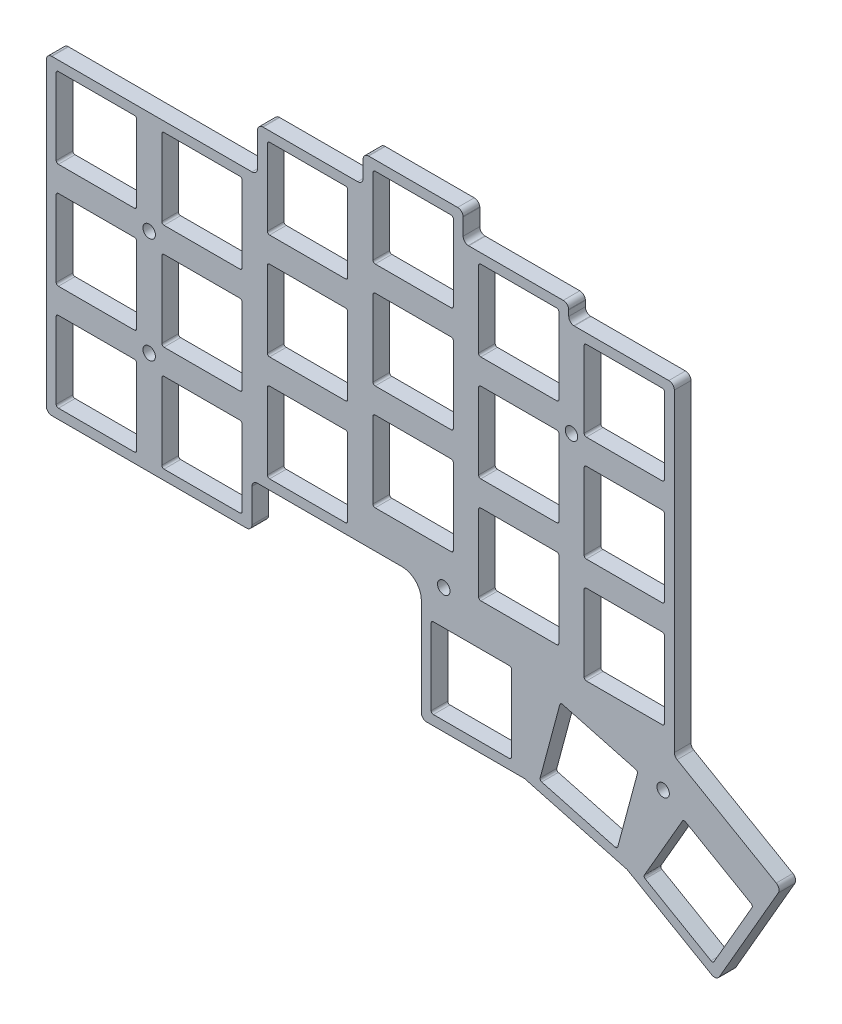
from build123d import *

# Parameters (mm, degrees)
BOSS_EXTRUDE1_START = 5
BOSS_EXTRUDE1_DEPTH = 3
CUT_EXTRUDE1_DEPTH  = 3
CUT_EXTRUDE2_DEPTH  = 3
CUT_EXTRUDE3_DEPTH  = 3
SKETCH6_R           = 1.125
CUT_EXTRUDE4_DEPTH  = 3


with BuildPart() as part:
    # Sketch1 → Boss-Extrude1 (new body)
    with BuildSketch(Plane.XY.offset(BOSS_EXTRUDE1_START)):
        with BuildLine():
            Line((-43.412279, 85.144111), (-59.462279, 85.144111))
            Line((-59.462279, 85.144111), (-59.560533, 85.141704))
            ThreePointArc((-59.560533, 85.141704), (-60.204711116, 84.817640196), (-60.462279, 84.144111))
            Line((-60.462279, 84.144111), (-60.462279, 81.144111))
            Line((-60.462279, 81.144111), (-60.464686, 81.045857))
            ThreePointArc((-60.464686, 81.045857), (-60.788749804, 80.401678884), (-61.462279, 80.144111))
            Line((-61.462279, 80.144111), (-67.612279, 80.144111))
            Line((-67.612279, 80.144111), (-72.362279, 80.144111))
            Line((-72.362279, 80.144111), (-78.512279, 80.144111))
            Line((-78.512279, 80.144111), (-78.610533, 80.141704))
            ThreePointArc((-78.610533, 80.141704), (-79.254711116, 79.817640196), (-79.512279, 79.144111))
            Line((-79.512279, 79.144111), (-79.512279, 73.144111))
            Line((-79.512279, 73.144111), (-79.514686, 73.045857))
            ThreePointArc((-79.514686, 73.045857), (-79.838749804, 72.401678884), (-80.512279, 72.144111))
            Line((-80.512279, 72.144111), (-116.612279, 72.144111))
            Line((-116.612279, 72.144111), (-116.710533, 72.141704))
            ThreePointArc((-116.710533, 72.141704), (-117.354711116, 71.817640196), (-117.612279, 71.144111))
            Line((-117.612279, 71.144111), (-117.612279, 16.994111))
            Line((-117.612279, 16.994111), (-117.609872, 16.895857))
            ThreePointArc((-117.609872, 16.895857), (-117.285808196, 16.251678884), (-116.612279, 15.994111))
            Line((-116.612279, 15.994111), (-101.437279, 15.994111))
            Line((-101.437279, 15.994111), (-96.687279, 15.994111))
            Line((-96.687279, 15.994111), (-81.512279, 15.994111))
            Line((-81.512279, 15.994111), (-81.414025, 15.996518))
            ThreePointArc((-81.414025, 15.996518), (-80.769846884, 16.320581804), (-80.512279, 16.994111))
            Line((-80.512279, 16.994111), (-80.512279, 22.994111))
            Line((-80.512279, 22.994111), (-80.509872, 23.092365))
            ThreePointArc((-80.509872, 23.092365), (-80.185808196, 23.736543116), (-79.512279, 23.994111))
            Line((-79.512279, 23.994111), (-53.462279, 23.994111))
            Line((-53.462279, 23.994111), (-53.278977, 23.991713))
            ThreePointArc((-53.278977, 23.991713), (-50.922055604, 22.905352629), (-49.962279, 20.494111))
            Line((-49.962279, 20.494111), (-49.962279, 2.944111))
            Line((-49.962279, 2.944111), (-49.959872, 2.845857))
            ThreePointArc((-49.959872, 2.845857), (-49.635808196, 2.201678884), (-48.962279, 1.944111))
            Line((-48.962279, 1.944111), (-31.346453, 1.944111))
            Line((-31.346453, 1.944111), (-12.818399, -3.020466))
            Line((-12.818399, -3.020466), (2.437354, -11.828379))
            Line((2.437354, -11.828379), (2.523644, -11.875428))
            ThreePointArc((2.523644, -11.875428), (3.24353, -11.916930612), (3.803337, -11.462426))
            Line((3.803337, -11.462426), (17.333763, 11.972959))
            Line((17.333763, 11.972959), (17.375769, 12.049527))
            ThreePointArc((17.375769, 12.049527), (17.445855835, 12.255982525), (17.467721, 12.472911))
            Line((17.467721, 12.472911), (17.467721, 76.144111))
            Line((17.467721, 76.144111), (17.465314, 76.242365))
            ThreePointArc((17.465314, 76.242365), (17.141250196, 76.886543116), (16.467721, 77.144111))
            Line((16.467721, 77.144111), (-22.362279, 77.144111))
            Line((-22.362279, 77.144111), (-22.460533, 77.146518))
            ThreePointArc((-22.460533, 77.146518), (-23.104711116, 77.470581804), (-23.362279, 78.144111))
            Line((-23.362279, 78.144111), (-23.362279, 79.144111))
            Line((-23.362279, 79.144111), (-23.364686, 79.242365))
            ThreePointArc((-23.364686, 79.242365), (-23.688749804, 79.886543116), (-24.362279, 80.144111))
            Line((-24.362279, 80.144111), (-30.512279, 80.144111))
            Line((-30.512279, 80.144111), (-35.262279, 80.144111))
            Line((-35.262279, 80.144111), (-41.412279, 80.144111))
            Line((-41.412279, 80.144111), (-41.510533, 80.146518))
            ThreePointArc((-41.510533, 80.146518), (-42.154711116, 80.470581804), (-42.412279, 81.144111))
            Line((-42.412279, 81.144111), (-42.412279, 84.144111))
            Line((-42.412279, 84.144111), (-42.414686, 84.242365))
            ThreePointArc((-42.414686, 84.242365), (-42.738749804, 84.886543116), (-43.412279, 85.144111))
        make_face()
    extrude(amount=-BOSS_EXTRUDE1_DEPTH)

    # Sketch2 → Cut-Extrude1 (cut)
    with BuildSketch(Plane.XY.offset(5)):
        with BuildLine():
            Line((-101.737279, 55.869111), (-115.437279, 55.869111))
            ThreePointArc((-115.437279, 55.869111), (-115.720121712, 55.986268288), (-115.837279, 56.269111))
            Line((-115.837279, 56.269111), (-115.837279, 69.969111))
            ThreePointArc((-115.837279, 69.969111), (-115.720121712, 70.251953712), (-115.437279, 70.369111))
            Line((-115.437279, 70.369111), (-101.737279, 70.369111))
            ThreePointArc((-101.737279, 70.369111), (-101.454436288, 70.251953712), (-101.337279, 69.969111))
            Line((-101.337279, 69.969111), (-101.337279, 56.269111))
            ThreePointArc((-101.337279, 56.269111), (-101.454436288, 55.986268288), (-101.737279, 55.869111))
        make_face()
    cut_extrude1 = extrude(amount=-CUT_EXTRUDE1_DEPTH, mode=Mode.SUBTRACT)

    # Sketch-Pattern1: Cut-Extrude1 at 18 more places
    with Locations((0, -38.1, 0), (0, -19.05, 0), (19.05, -38.1, 0), (19.05, -19.05, 0), (19.05, 0, 0), (38.1, -11.05, 0), (38.1, -30.1, 0), (57.15, -25.1, 0), (57.15, -6.05, 0), (57.15, 13, 0), (38.1, 8, 0), (76.2, 8, 0), (76.2, -11.05, 0), (76.2, -30.1, 0), (67.65, -52.15, 0), (95.25, -33.1, 0), (95.25, -14.05, 0), (95.25, 5, 0)):
        add(cut_extrude1, mode=Mode.SUBTRACT)

    # Sketch4 → Cut-Extrude2 (cut)
    with BuildSketch(Plane.XY.offset(5)):
        with BuildLine():
            Line((-24.48673788, 16.955175674), (-11.253554041, 13.409354827))
            ThreePointArc((-11.253554041, 13.409354827), (-11.010671497, 13.222984498), (-10.970711326, 12.91945688))
            Line((-10.970711326, 12.91945688), (-14.516532173, -0.313726959))
            ThreePointArc((-14.516532173, -0.313726959), (-14.702902502, -0.556609503), (-15.00643012, -0.596569674))
            Line((-15.00643012, -0.596569674), (-28.239613959, 2.949251173))
            ThreePointArc((-28.239613959, 2.949251173), (-28.482496503, 3.135621502), (-28.522456674, 3.43914912))
            Line((-28.522456674, 3.43914912), (-24.976635827, 16.672332959))
            ThreePointArc((-24.976635827, 16.672332959), (-24.790265498, 16.915215503), (-24.48673788, 16.955175674))
        make_face()
        with BuildLine():
            Line((2.307274016, -9.703684177), (-9.557274016, -2.853684177))
            ThreePointArc((-9.557274016, -2.853684177), (-9.743644346, -2.610801634), (-9.703684177, -2.307274016))
            Line((-9.703684177, -2.307274016), (-2.853684177, 9.557274016))
            ThreePointArc((-2.853684177, 9.557274016), (-2.610801634, 9.743644346), (-2.307274016, 9.703684177))
            Line((-2.307274016, 9.703684177), (9.557274016, 2.853684177))
            ThreePointArc((9.557274016, 2.853684177), (9.743644346, 2.610801634), (9.703684177, 2.307274016))
            Line((9.703684177, 2.307274016), (2.853684177, -9.557274016))
            ThreePointArc((2.853684177, -9.557274016), (2.610801634, -9.743644346), (2.307274016, -9.703684177))
        make_face()
    extrude(amount=-CUT_EXTRUDE2_DEPTH, mode=Mode.SUBTRACT)

    # Sketch5 → Cut-Extrude3 (cut)
    with BuildSketch(Plane.XY.offset(5)):
        with BuildLine():
            Line((-12.903744032, 77.144111), (-5.312279, 77.144111))
            ThreePointArc((-5.312279, 77.144111), (-4.605172219, 76.851217781), (-4.312279, 76.144111))
            Line((-4.312279, 76.144111), (-4.312279, 19.521528383))
            ThreePointArc((-4.312279, 19.521528383), (-4.178304404, 19.021528383), (-3.812279, 18.655502979))
            Line((-3.812279, 18.655502979), (14.074853399, 8.328362273))
            ThreePointArc((14.074853399, 8.328362273), (14.540779225, 7.721155915), (14.440878803, 6.96233687))
            Line((14.440878803, 6.96233687), (7.754308024, -4.619143447))
            Line((7.754308024, -4.619143447), (24.75284052, -3.869886779))
            Line((24.75284052, -3.869886779), (24.75284052, 82.882476135))
            Line((24.75284052, 82.882476135), (-12.903744032, 94.38391813))
            Line((-12.903744032, 94.38391813), (-12.903744032, 77.144111))
        make_face()
    extrude(amount=-CUT_EXTRUDE3_DEPTH, mode=Mode.SUBTRACT)

    # Sketch6 → Cut-Extrude4 (cut)
    with BuildSketch(Plane(origin=(0, 0, 2), x_dir=(-1, 0, 0), z_dir=(0, 0, -1))):
        with Locations((99.062279, 34.544111)):
            Circle(SKETCH6_R)
        with Locations((99.062279, 53.594111)):
            Circle(SKETCH6_R)
        with Locations((45.912279, 24.494111)):
            Circle(SKETCH6_R)
        with Locations((6.333841, 12.634642)):
            Circle(SKETCH6_R)
        with Locations((22.862279, 60.094111)):
            Circle(SKETCH6_R)
    extrude(amount=-CUT_EXTRUDE4_DEPTH, mode=Mode.SUBTRACT)


solid = part.part
